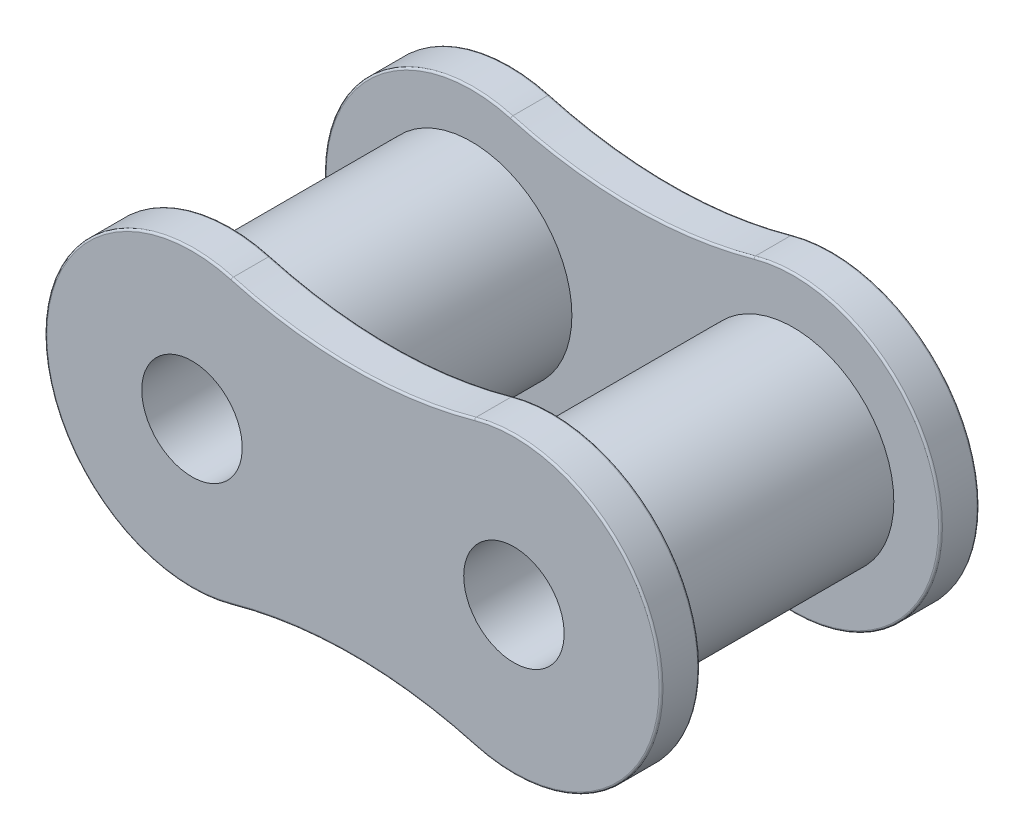
from build123d import *

# Parameters (mm, degrees)
BOSS_EXTRUDE1_START     = 5.5118
SKETCH2_R               = 3.9624
SKETCH2_R_2             = 1.9812
BOSS_EXTRUDE1_DEPTH     = 10
BOSS_EXTRUDE1_2_DEPTH   = 10
FILLET1_R               = 0.158496
FILLET2_R               = 0.158496
BOSS_EXTRUDE2_START     = 7.0358
SKETCH3_R               = 1.9812
BOSS_EXTRUDE2_DEPTH     = 1.524
BOSS_EXTRUDE3_START     = -3.9878
SKETCH3_3_R             = 1.9812
BOSS_EXTRUDE3_DEPTH     = 1.524
CUT_EXTRUDE1_DEPTH      = 16.195559288
CUT_EXTRUDE1_DEPTH_BACK = 16.195559288
SKETCH4_R               = 2.57556
SKETCH4_R_2             = 1.9812
FILLET3_R               = 0.0762
BOSS_EXTRUDE4_START     = -5.5118
SKETCH4_2_R             = 2.57556
SKETCH4_2_R_2           = 1.9812
BOSS_EXTRUDE4_DEPTH     = 12.5476


with BuildPart() as part:
    # Sketch2 → Boss-Extrude1 (new body)
    with BuildSketch(Plane.XY.offset(BOSS_EXTRUDE1_START)):
        with Locations((-6.35, 0)):
            Circle(SKETCH2_R)
        with Locations((-6.35, 0)):
            Circle(SKETCH2_R_2, mode=Mode.SUBTRACT)
    extrude(amount=-BOSS_EXTRUDE1_DEPTH)

    # Fillet1
    fillet1_edges = [part.edges().sort_by_distance(p)[0] for p in [
        (-10.3124, 0, -4.4882),
        (-10.3124, 0, 5.5118),
    ]]
    fillet(fillet1_edges, radius=FILLET1_R)



with BuildPart() as body_2:
    # Sketch2 → Boss-Extrude1 2 (new body)
    with BuildSketch(Plane.XY.offset(BOSS_EXTRUDE1_START)):
        with Locations((6.35, 0)):
            Circle(SKETCH2_R)
        with Locations((6.35, 0)):
            Circle(SKETCH2_R_2, mode=Mode.SUBTRACT)
    extrude(amount=-BOSS_EXTRUDE1_2_DEPTH)

    # Fillet2
    fillet2_edges = [body_2.edges().sort_by_distance(p)[0] for p in [
        (2.3876, 0, 5.5118),
        (2.3876, 0, -4.4882),
    ]]
    fillet(fillet2_edges, radius=FILLET2_R)


with BuildPart() as part_1:
    add(part.part)

    add(body_2.part)  # Boss-Extrude2 merges body 2
    # Sketch3 → Boss-Extrude2 (add)
    with BuildSketch(Plane.XY.offset(BOSS_EXTRUDE2_START)):
        with BuildLine():
            ThreePointArc((-4.787931893, 5.589740462), (-12.1539, 0), (-4.787931893, -5.589740462))
            ThreePointArc((-4.787931893, -5.589740462), (0, -4.933315), (4.787931893, -5.589740462))
            ThreePointArc((4.787931893, -5.589740462), (12.1539, 0), (4.787931893, 5.589740462))
            ThreePointArc((4.787931893, 5.589740462), (0, 4.933315), (-4.787931893, 5.589740462))
        make_face()
        with Locations(Location((6.35, 0, 0), (0, 0, 180))):
            Circle(SKETCH3_R, mode=Mode.SUBTRACT)
        with Locations((-6.35, 0)):
            Circle(SKETCH3_R, mode=Mode.SUBTRACT)
    extrude(amount=-BOSS_EXTRUDE2_DEPTH)

    # Sketch3<3> → Boss-Extrude3 (add)
    with BuildSketch(Plane.XY.offset(BOSS_EXTRUDE3_START)):
        with BuildLine():
            ThreePointArc((-4.787931893, 5.589740462), (-12.1539, 0), (-4.787931893, -5.589740462))
            ThreePointArc((-4.787931893, -5.589740462), (0, -4.933315), (4.787931893, -5.589740462))
            ThreePointArc((4.787931893, -5.589740462), (12.1539, 0), (4.787931893, 5.589740462))
            ThreePointArc((4.787931893, 5.589740462), (0, 4.933315), (-4.787931893, 5.589740462))
        make_face()
        with Locations(Location((6.35, 0, 0), (0, 0, 180))):
            Circle(SKETCH3_3_R, mode=Mode.SUBTRACT)
        with Locations((-6.35, 0)):
            Circle(SKETCH3_3_R, mode=Mode.SUBTRACT)
    extrude(amount=-BOSS_EXTRUDE3_DEPTH)

    # Sketch4 → Cut-Extrude1 (cut, two sides: drawn at the far end of the back side and taken through both)
    # profile 1 of 2: a face of its own
    with BuildSketch(Plane.XY.offset(-CUT_EXTRUDE1_DEPTH_BACK)):
        with Locations((-6.35, 0)):
            Circle(SKETCH4_R)
        with Locations((-6.35, 0)):
            Circle(SKETCH4_R_2, mode=Mode.SUBTRACT)
    # profile 2 of 2: a face of its own
    with BuildSketch(Plane.XY.offset(-CUT_EXTRUDE1_DEPTH_BACK)):
        with Locations((6.35, 0)):
            Circle(SKETCH4_R)
        with Locations((6.35, 0)):
            Circle(SKETCH4_R_2, mode=Mode.SUBTRACT)
    extrude(amount=CUT_EXTRUDE1_DEPTH + CUT_EXTRUDE1_DEPTH_BACK, mode=Mode.SUBTRACT)

    # Fillet3
    fillet3_edges = [part_1.edges().sort_by_distance(p)[0] for p in [
        (12.1539, 0, 7.0358),
        (-12.1539, 0, 7.0358),
        (0, -4.933315, 5.5118),
        (0, 4.933315, 5.5118),
        (0, -4.933315, 7.0358),
        (12.1539, 0, 5.5118),
        (0, 4.933315, 7.0358),
        (-12.1539, 0, 5.5118),
        (0, 4.933315, -3.9878),
        (-12.1539, 0, -3.9878),
        (0, -4.933315, -3.9878),
        (12.1539, 0, -3.9878),
        (0, 4.933315, -5.5118),
        (-12.1539, 0, -5.5118),
        (0, -4.933315, -5.5118),
        (12.1539, 0, -5.5118),
    ]]
    fillet(fillet3_edges, radius=FILLET3_R)

    # Sketch4<2> → Boss-Extrude4 (add, through all)
    # profile 1 of 2: a face of its own
    with BuildSketch(Plane.XY.offset(BOSS_EXTRUDE4_START)):
        with Locations((-6.35, 0)):
            Circle(SKETCH4_2_R)
        with Locations(Location((-6.35, 0, 0), (0, 0, 180))):
            Circle(SKETCH4_2_R_2, mode=Mode.SUBTRACT)
    # profile 2 of 2: a face of its own
    with BuildSketch(Plane.XY.offset(BOSS_EXTRUDE4_START)):
        with Locations((6.35, 0)):
            Circle(SKETCH4_2_R)
        with Locations(Location((6.35, 0, 0), (0, 0, 180))):
            Circle(SKETCH4_2_R_2, mode=Mode.SUBTRACT)
    extrude(amount=BOSS_EXTRUDE4_DEPTH)


solid = part_1.part
